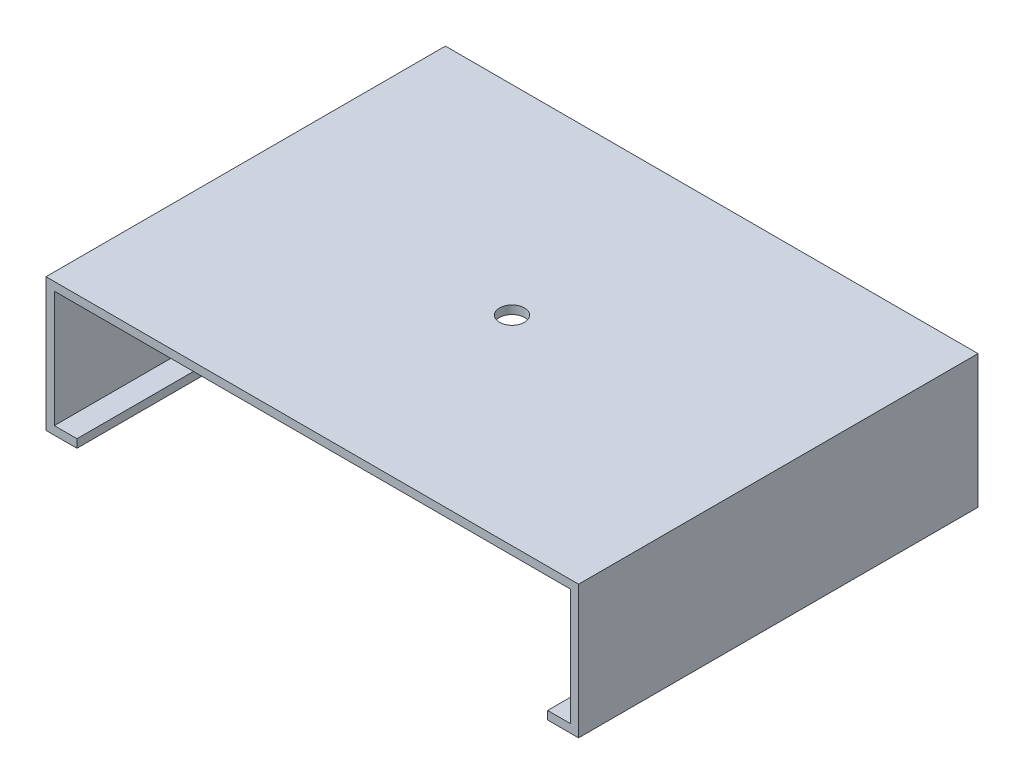
from build123d import *

# Parameters (mm, degrees)
SKETCH1_W           = 203.2
SKETCH1_H           = 50.8
SKETCH1_W_2         = 196.85
SKETCH1_H_2         = 44.45
BOSS_EXTRUDE1_DEPTH = 152.4
SKETCH2_W           = 179.578
SKETCH2_H           = 152.4
CUT_EXTRUDE1_DEPTH  = 3.175
SKETCH3_R           = 4.7625
CUT_EXTRUDE2_DEPTH  = 191.076195248


with BuildPart() as part:
    # Sketch1 → Boss-Extrude1 (new body)
    with BuildSketch(Plane.XY):
        Rectangle(SKETCH1_W, SKETCH1_H)
        Rectangle(SKETCH1_W_2, SKETCH1_H_2, mode=Mode.SUBTRACT)
    extrude(amount=BOSS_EXTRUDE1_DEPTH)

    # Sketch2 → Cut-Extrude1 (cut)
    with BuildSketch(Plane.XZ.offset(25.4)):
        with Locations((0, 76.2)):
            Rectangle(SKETCH2_W, SKETCH2_H)
    extrude(amount=-CUT_EXTRUDE1_DEPTH, mode=Mode.SUBTRACT)

    # Sketch3 → Cut-Extrude2 (cut, through all)
    with BuildSketch(Plane(origin=(0, 25.4, 0), x_dir=(1, 0, 0), z_dir=(0, 1, 0))):
        with Locations(Location((0, -76.2, 0), (0, 0, 270))):
            Circle(SKETCH3_R)
    extrude(amount=-CUT_EXTRUDE2_DEPTH, mode=Mode.SUBTRACT)


solid = part.part
